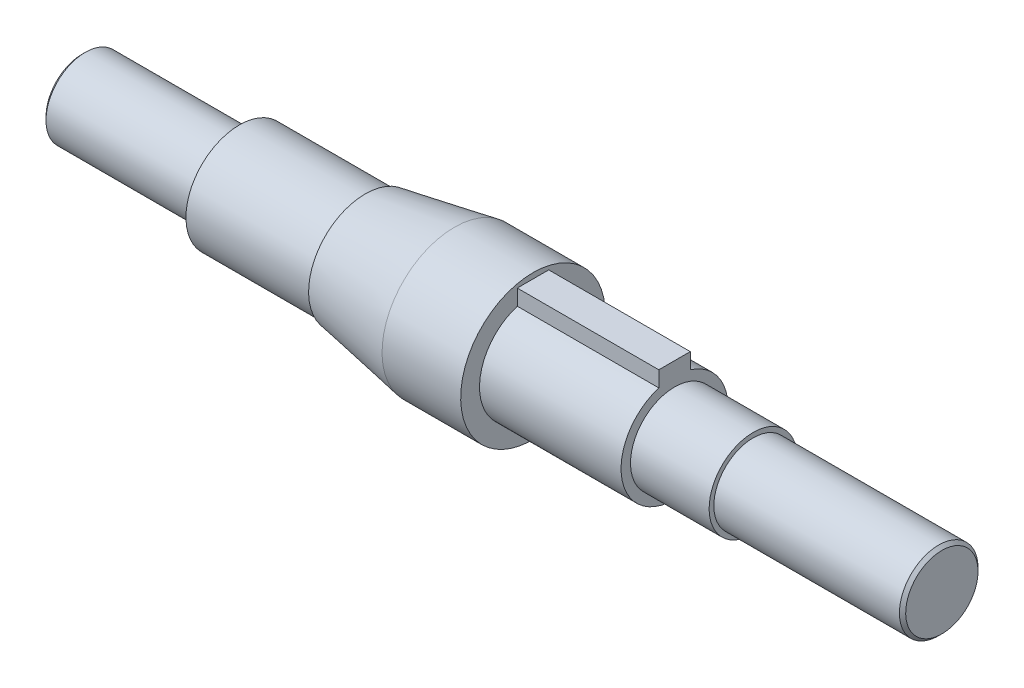
from build123d import *

# Parameters (mm, degrees)
SKETCH2_W           = 10
SKETCH2_H           = 5
BOSS_EXTRUDE1_DEPTH = 45
CHAMFER1_SIZE       = 1


with BuildPart() as part:
    # Sketch1 → Revolve1 (revolve)
    with BuildSketch(Plane.XY):
        Polygon((-136.678204549, 0), (-136.678204549, 12.5), (-86.678204549, 12.5), (-86.678204549, 17), (-46.678204549, 17), (-46.678204549, 18), (-18.321795451, 23), (6.678204549, 23), (6.678204549, 17), (51.678204549, 17), (51.678204549, 14), (76.678204549, 14), (76.678204549, 12.5), (136.678204549, 12.5), (136.678204549, 0), align=None)
    revolve(axis=Axis((136.678204549, 0, 0), (-1, 0, 0)))

    # Sketch2 → Boss-Extrude1 (add)
    with BuildSketch(Plane(origin=(51.678204549, 0, 0), x_dir=(0, 0, -1), z_dir=(1, 0, 0))):
        with Locations((0, 18.748076809)):
            Rectangle(SKETCH2_W, SKETCH2_H)
    extrude(amount=-BOSS_EXTRUDE1_DEPTH)

    # Chamfer1
    chamfer1_edges = [part.edges().sort_by_distance(p)[0] for p in [
        (136.678204549, -12.5, 0),
        (-136.678204549, -12.5, 0),
    ]]
    chamfer(chamfer1_edges, length=CHAMFER1_SIZE)


solid = part.part
